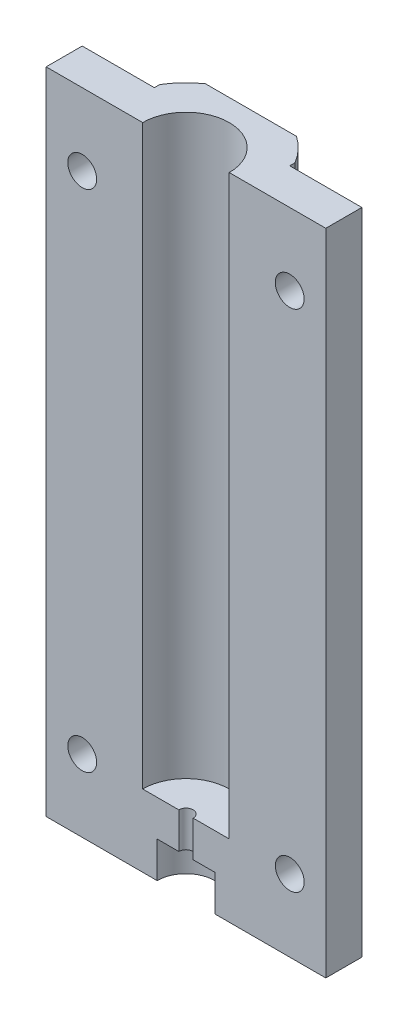
from build123d import *
from build123d.topology import SkipClean

# Parameters (mm, degrees)
ROTATION1_ANGLE                      = 180
SCHNITT_LINEAR_AUSTRAGEN2_DEPTH      = 92.33454987
SCHNITT_LINEAR_AUSTRAGEN2_DEPTH_BACK = 90
SCHNITT_LINEAR_AUSTRAGEN3_DEPTH      = 92.33454987
SCHNITT_LINEAR_AUSTRAGEN3_DEPTH_BACK = 90
SKIZZE8_W                            = 10
SKIZZE8_H                            = 5
AUFSATZ_LINEAR_AUSTRAGEN2_DEPTH      = 90
SKIZZE9_W                            = 10
SKIZZE9_H                            = 5
AUFSATZ_LINEAR_AUSTRAGEN3_DEPTH      = 90
SKIZZE12_R                           = 1
SCHNITT_LINEAR_AUSTRAGEN5_DEPTH      = 20
SKIZZE13_W                           = 38.761249726
SKIZZE13_H                           = 19.724182296
SCHNITT_LINEAR_AUSTRAGEN7_DEPTH      = 90
SKIZZE14_R                           = 4
SCHNITT_LINEAR_AUSTRAGEN8_DEPTH      = 5
SKIZZE15_R                           = 2
SCHNITT_LINEAR_AUSTRAGEN9_DEPTH      = 93.258379674
SKIZZE17_W                           = 21.457385309
SKIZZE17_H                           = 2
SCHNITT_LINEAR_AUSTRAGEN16_DEPTH     = 93.717898057


with BuildPart() as part:
    # Skizze3 → Rotation1 (revolve)
    with BuildSketch(Plane.XY):
        Polygon((0, 0), (-11, 0), (-11, 90), (-6, 90), (-6, 10), (0, 10), align=None)
    revolve(axis=Axis((0, 0, 0), (0, 1, 0)), revolution_arc=ROTATION1_ANGLE)

    # Skizze6 → Schnitt-Linear austragen2 (cut, two sides: drawn at the far end of the back side and taken through both)
    with BuildSketch(Plane(origin=(0, 90, 0), x_dir=(1, 0, 0), z_dir=(0, 1, 0)).offset(-SCHNITT_LINEAR_AUSTRAGEN2_DEPTH_BACK)):
        Polygon((-9.380624863, -62.0642209), (-9.380624863, -5.744900102), (-9.380624863, 0), (-9.380624863, 56.319320799), (-122.01926646, 56.319320799), (-122.01926646, -62.0642209), align=None)
    extrude(amount=SCHNITT_LINEAR_AUSTRAGEN2_DEPTH + SCHNITT_LINEAR_AUSTRAGEN2_DEPTH_BACK, mode=Mode.SUBTRACT)

    # Skizze7 → Schnitt-Linear austragen3 (cut, two sides: drawn at the far end of the back side and taken through both)
    with BuildSketch(Plane.XZ.offset(-SCHNITT_LINEAR_AUSTRAGEN3_DEPTH_BACK)):
        Polygon((9.380624863, 59.241313346), (9.380624863, 5.744900102), (9.380624863, 0), (9.380624863, -53.496413245), (116.373451353, -53.496413245), (116.373451353, 59.241313346), align=None)
    extrude(amount=SCHNITT_LINEAR_AUSTRAGEN3_DEPTH + SCHNITT_LINEAR_AUSTRAGEN3_DEPTH_BACK, mode=Mode.SUBTRACT)

    # Skizze8 → Aufsatz-Linear austragen2 (add)
    with BuildSketch(Plane(origin=(0, 90, 0), x_dir=(1, 0, 0), z_dir=(0, 1, 0))):
        with Locations((-14.380624863, -2.5)):
            Rectangle(SKIZZE8_W, SKIZZE8_H)
    extrude(amount=-AUFSATZ_LINEAR_AUSTRAGEN2_DEPTH)

    # Skizze9 → Aufsatz-Linear austragen3 (add)
    with BuildSketch(Plane(origin=(0, 90, 0), x_dir=(1, 0, 0), z_dir=(0, 1, 0))):
        with Locations((14.380624863, -2.5)):
            Rectangle(SKIZZE9_W, SKIZZE9_H)
    extrude(amount=-AUFSATZ_LINEAR_AUSTRAGEN3_DEPTH)

    # Skizze12 → Schnitt-Linear austragen5 (cut)
    with BuildSketch(Plane(origin=(0, 0, 0), x_dir=(-1, 0, 0), z_dir=(0, -1, 0))):
        Circle(SKIZZE12_R)
    extrude(amount=-SCHNITT_LINEAR_AUSTRAGEN5_DEPTH, mode=Mode.SUBTRACT)

    # Spiegeln2: part across face


with BuildPart() as part_1:
    with SkipClean():  # the faces are left unmerged after this step: merging them gives an invalid solid
        add(part.part)
        add(part.part.mirror(Plane(origin=(12.323947404, 43.405429497, 0), x_dir=(1, 0, 0), z_dir=(0, 0, -1))))

    # Skizze13 → Schnitt-Linear austragen7 (cut)
    with BuildSketch(Plane(origin=(0, 0, 0), x_dir=(-1, 0, 0), z_dir=(0, -1, 0))):
        with Locations((0, -9.862091148)):
            Rectangle(SKIZZE13_W, SKIZZE13_H)
    extrude(amount=-SCHNITT_LINEAR_AUSTRAGEN7_DEPTH, mode=Mode.SUBTRACT)

    # Skizze14 → Schnitt-Linear austragen8 (cut)
    with BuildSketch(Plane(origin=(0, 0, 0), x_dir=(-1, 0, 0), z_dir=(0, -1, 0))):
        Circle(SKIZZE14_R)
    extrude(amount=-SCHNITT_LINEAR_AUSTRAGEN8_DEPTH, mode=Mode.SUBTRACT)

    # Skizze15 → Schnitt-Linear austragen9 (cut, through all)
    with BuildSketch(Plane(origin=(0, 0, -5), x_dir=(-1, 0, 0), z_dir=(0, 0, -1))):
        with Locations((-14.380624863, 80)):
            Circle(SKIZZE15_R)
        with Locations((-14.392959085, 10)):
            Circle(SKIZZE15_R)
        with Locations((14.380624863, 10)):
            Circle(SKIZZE15_R)
        with Locations((14.380624863, 80)):
            Circle(SKIZZE15_R)
    extrude(amount=-SCHNITT_LINEAR_AUSTRAGEN9_DEPTH, mode=Mode.SUBTRACT)

    # Skizze17 → Schnitt-Linear austragen16 (cut, through all)
    with BuildSketch(Plane(origin=(0, 90, 0), x_dir=(1, 0, 0), z_dir=(0, 1, 0))):
        with Locations((0.273845189, 10.009257492)):
            Rectangle(SKIZZE17_W, SKIZZE17_H)
    extrude(amount=-SCHNITT_LINEAR_AUSTRAGEN16_DEPTH, mode=Mode.SUBTRACT)


solid = part_1.part
